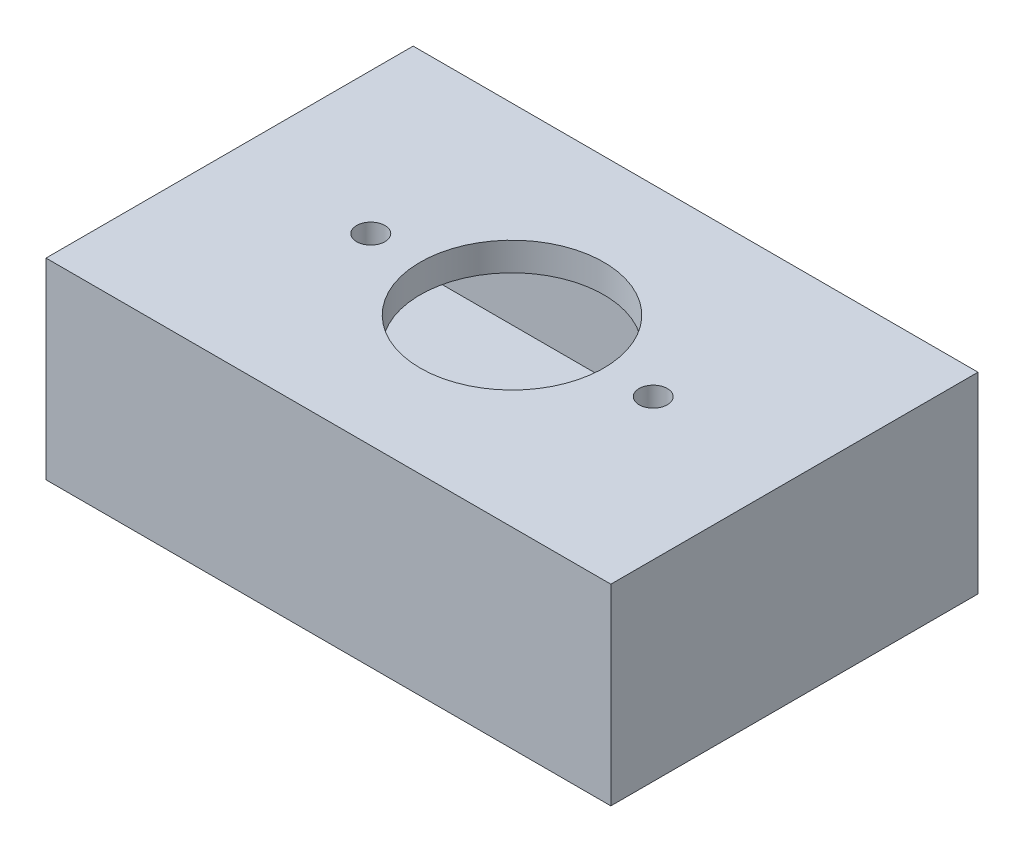
from build123d import *

# Parameters (mm, degrees)
SKETCH1_W           = 200
SKETCH1_H           = 130
BOSS_EXTRUDE1_DEPTH = 58
SHELL1_T            = -10
SKETCH2_R           = 1.5
CUT_EXTRUDE1_DEPTH  = 129.565158577
SKETCH3_W           = 200
SKETCH3_H           = 130
BOSS_EXTRUDE2_DEPTH = 10
CUT_EXTRUDE2_REACH  = 139.292
SKETCH4_R           = 32.5
SKETCH4_R_2         = 5


with BuildPart() as part:
    # Sketch1 → Boss-Extrude1 (new body)
    with BuildSketch(Plane(origin=(0, 0, 0), x_dir=(1, 0, 0), z_dir=(0, 1, 0))):
        Rectangle(SKETCH1_W, SKETCH1_H)
    extrude(amount=BOSS_EXTRUDE1_DEPTH)

    # Shell1
    shell1_openings = [part.faces().sort_by_distance(p)[0] for p in [
        (0, 58, 0),
    ]]
    offset(amount=SHELL1_T, openings=shell1_openings, kind=Kind.INTERSECTION)

    # Sketch2 → Cut-Extrude1 (cut, through all)
    with BuildSketch(Plane(origin=(0, 10, 0), x_dir=(1, 0, 0), z_dir=(0, 1, 0))):
        with Locations(Location((-15.5, 15.5, 0), (0, 0, 270))):
            Circle(SKETCH2_R)
        with Locations(Location((15.5, 15.5, 0), (0, 0, 270))):
            Circle(SKETCH2_R)
        with Locations(Location((-15.5, -15.5, 0), (0, 0, 270))):
            Circle(SKETCH2_R)
        with Locations(Location((15.5, -15.5, 0), (0, 0, 270))):
            Circle(SKETCH2_R)
    extrude(amount=-CUT_EXTRUDE1_DEPTH, mode=Mode.SUBTRACT)

    # Sketch3 → Boss-Extrude2 (add)
    with BuildSketch(Plane(origin=(0, 58, 0), x_dir=(1, 0, 0), z_dir=(0, 1, 0))):
        Rectangle(SKETCH3_W, SKETCH3_H)
    extrude(amount=BOSS_EXTRUDE2_DEPTH)

    # Sketch4 → Cut-Extrude2 (cut, up to next)
    with BuildSketch(Plane(origin=(0, 68, 0), x_dir=(1, 0, 0), z_dir=(0, 1, 0)), mode=Mode.PRIVATE) as cut_extrude2_sk1:
        with Locations(Location((0, 0, 0), (0, 0, 270))):
            Circle(SKETCH4_R)
    cut_extrude2_tool1 = extrude(cut_extrude2_sk1.sketch, amount=-CUT_EXTRUDE2_REACH, mode=Mode.PRIVATE) & part.part
    # Sketch4 → Cut-Extrude2 (cut, up to next)
    with BuildSketch(Plane(origin=(0, 68, 0), x_dir=(1, 0, 0), z_dir=(0, 1, 0)), mode=Mode.PRIVATE) as cut_extrude2_sk2:
        with Locations(Location((-50, 0, 0), (0, 0, 270))):
            Circle(SKETCH4_R_2)
    cut_extrude2_tool2 = extrude(cut_extrude2_sk2.sketch, amount=-CUT_EXTRUDE2_REACH, mode=Mode.PRIVATE) & part.part
    # Sketch4 → Cut-Extrude2 (cut, up to next)
    with BuildSketch(Plane(origin=(0, 68, 0), x_dir=(1, 0, 0), z_dir=(0, 1, 0)), mode=Mode.PRIVATE) as cut_extrude2_sk3:
        with Locations(Location((50, 0, 0), (0, 0, 270))):
            Circle(SKETCH4_R_2)
    cut_extrude2_tool3 = extrude(cut_extrude2_sk3.sketch, amount=-CUT_EXTRUDE2_REACH, mode=Mode.PRIVATE) & part.part
    add(cut_extrude2_tool1.solids().sort_by_distance((0, 68, 0))[0], mode=Mode.SUBTRACT)
    add(cut_extrude2_tool2.solids().sort_by_distance((-50, 68, 0))[0], mode=Mode.SUBTRACT)
    add(cut_extrude2_tool3.solids().sort_by_distance((50, 68, 0))[0], mode=Mode.SUBTRACT)


solid = part.part
